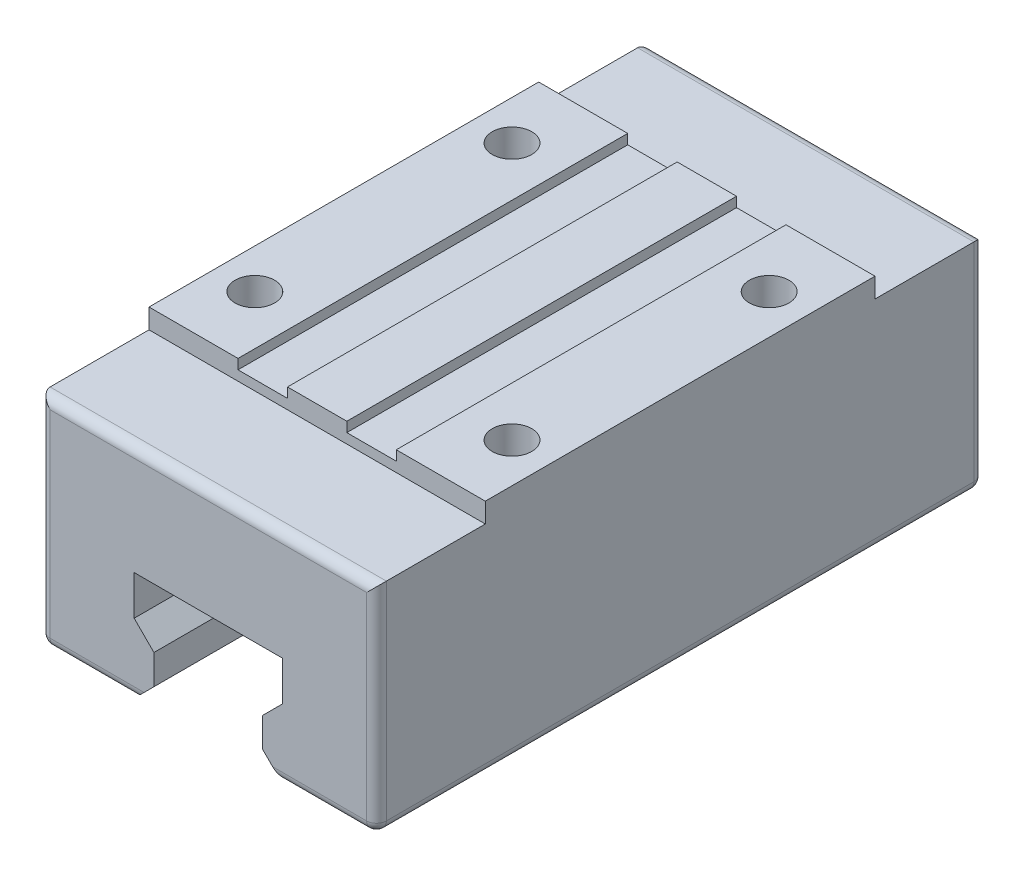
from build123d import *

# Parameters (mm, degrees)
BOSS_EXTRUDE1_DEPTH = 30.7
SKETCH4_W           = 34
SKETCH4_H           = 39.4
SKETCH4_R           = 2
BOSS_EXTRUDE2_DEPTH = 2
SKETCH5_W           = 5
SKETCH5_H           = 39.4
CUT_EXTRUDE1_DEPTH  = 1
FILLET1_R           = 1
FILLET2_R           = 1
CUT_EXTRUDE2_START  = -5.95
SKETCH6_R           = 2
CUT_EXTRUDE2_DEPTH  = 5.95


with BuildPart() as part:
    # Sketch1 → Boss-Extrude1 (new, symmetric)
    with BuildSketch(Plane.XY):
        Polygon((0, 15), (0, 26), (-17, 26), (-17, 4), (-7.5, 4), (-5.5, 6), (-5.5, 9), (-7.5, 11), (-7.5, 15), align=None)
        Polygon((17, 26), (0, 26), (0, 15), (7.5, 15), (7.5, 11), (5.5, 9), (5.5, 6), (7.5, 4), (17, 4), align=None)
    extrude(amount=BOSS_EXTRUDE1_DEPTH, both=True)

    # Sketch4 → Boss-Extrude2 (add)
    with BuildSketch(Plane(origin=(0, 26, 0), x_dir=(1, 0, 0), z_dir=(0, 1, 0))):
        Rectangle(SKETCH4_W, SKETCH4_H)
        with Locations(Location((-13, 13, 0), (0, 0, 180))):
            Circle(SKETCH4_R, mode=Mode.SUBTRACT)
        with Locations((13, 13)):
            Circle(SKETCH4_R, mode=Mode.SUBTRACT)
        with Locations((-13, -13)):
            Circle(SKETCH4_R, mode=Mode.SUBTRACT)
        with Locations(Location((13, -13, 0), (0, 0, 180))):
            Circle(SKETCH4_R, mode=Mode.SUBTRACT)
    extrude(amount=BOSS_EXTRUDE2_DEPTH)

    # Sketch5 → Cut-Extrude1 (cut)
    with BuildSketch(Plane(origin=(0, 28, 0), x_dir=(1, 0, 0), z_dir=(0, 1, 0))):
        with Locations((-5.5, 0)):
            Rectangle(SKETCH5_W, SKETCH5_H)
        with Locations((5.5, 0)):
            Rectangle(SKETCH5_W, SKETCH5_H)
    extrude(amount=-CUT_EXTRUDE1_DEPTH, mode=Mode.SUBTRACT)

    # Fillet1
    fillet1_edges = [part.edges().sort_by_distance(p)[0] for p in [
        (-17, 4, 0),
        (17, 4, 0),
    ]]
    fillet(fillet1_edges, radius=FILLET1_R)

    # Fillet2
    fillet2_edges = [part.edges().sort_by_distance(p)[0] for p in [
        (-17, 15.5, -30.7),
        (17, 15.5, -30.7),
        (16.707106781, 4.292893219, -30.7),
        (-16.707106781, 4.292893219, -30.7),
        (-17, 15.5, 30.7),
        (17, 15.5, 30.7),
        (16.707106781, 4.292893219, 30.7),
        (-16.707106781, 4.292893219, 30.7),
        (-11.75, 4, -30.7),
        (0, 26, -30.7),
        (11.75, 4, -30.7),
        (11.75, 4, 30.7),
        (0, 26, 30.7),
        (-11.75, 4, 30.7),
    ]]
    fillet(fillet2_edges, radius=FILLET2_R)

    # Sketch6 → Cut-Extrude2 (cut)
    with BuildSketch(Plane(origin=(0, 28, 0), x_dir=(1, 0, 0), z_dir=(0, 1, 0)).offset(CUT_EXTRUDE2_START)):
        with Locations((-13, -13)):
            Circle(SKETCH6_R)
        with Locations(Location((13, -13, 0), (0, 0, 270))):
            Circle(SKETCH6_R)
        with Locations((13, 13)):
            Circle(SKETCH6_R)
        with Locations(Location((-13, 13, 0), (0, 0, 270))):
            Circle(SKETCH6_R)
    extrude(amount=CUT_EXTRUDE2_DEPTH, mode=Mode.SUBTRACT)


solid = part.part
